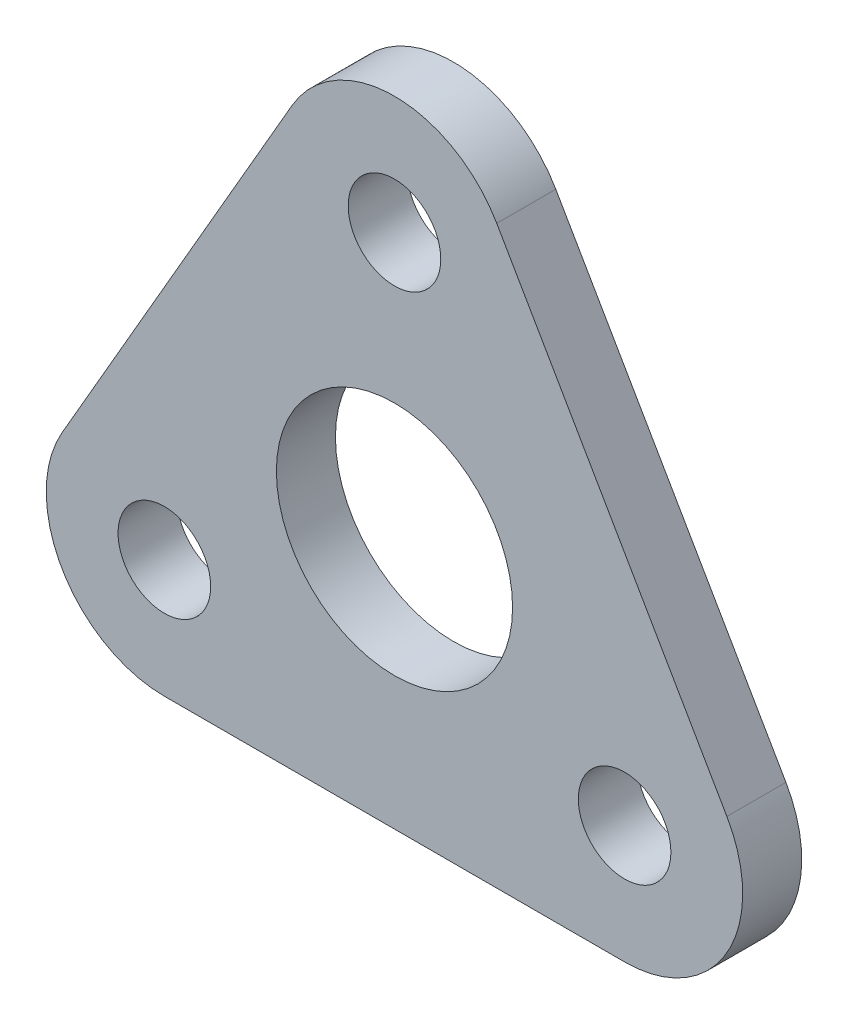
from build123d import *

# Parameters (mm, degrees)
SKETCH1_R           = 6.35
SKETCH1_R_2         = 2.4892
BOSS_EXTRUDE1_DEPTH = 3.175
FILLET1_R           = 6.35


with BuildPart() as part:
    # Sketch1 → Boss-Extrude1 (new body)
    with BuildSketch(Plane.XY):
        Polygon((0, 26.9875), (23.371860585, -13.49375), (-23.371860585, -13.49375), align=None)
        Circle(SKETCH1_R, mode=Mode.SUBTRACT)
        with Locations((0, 14.2875)):
            Circle(SKETCH1_R_2, mode=Mode.SUBTRACT)
        with Locations((12.373337957, -7.14375)):
            Circle(SKETCH1_R_2, mode=Mode.SUBTRACT)
        with Locations((-12.373337957, -7.14375)):
            Circle(SKETCH1_R_2, mode=Mode.SUBTRACT)
    extrude(amount=BOSS_EXTRUDE1_DEPTH)

    # Fillet1
    fillet1_edges = [part.edges().sort_by_distance(p)[0] for p in [
        (0, 26.9875, 1.5875),
        (23.371860585, -13.49375, 1.5875),
        (-23.371860585, -13.49375, 1.5875),
    ]]
    fillet(fillet1_edges, radius=FILLET1_R)


solid = part.part
